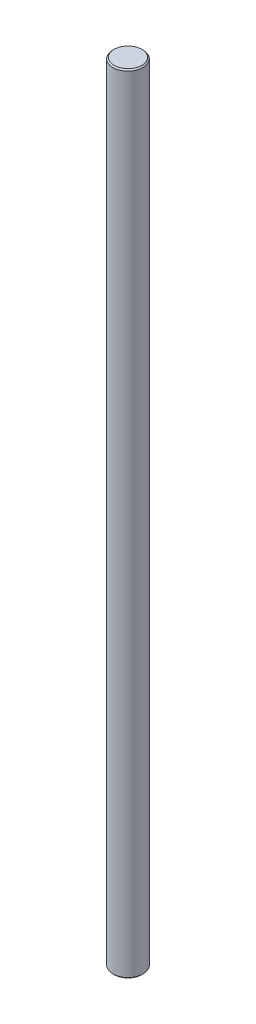
from build123d import *

# Parameters (mm, degrees)
CROQUIS1_R              = 6
SALIENTE_EXTRUIR1_DEPTH = 312
CHAFL_N1_SIZE           = 0.5


with BuildPart() as part:
    # Croquis1 → Saliente-Extruir1 (new body)
    with BuildSketch(Plane(origin=(0, 0, 0), x_dir=(1, 0, 0), z_dir=(0, 1, 0))):
        with Locations(Location((0, 0, 0), (0, 0, 270))):
            Circle(CROQUIS1_R)
    extrude(amount=SALIENTE_EXTRUIR1_DEPTH)

    # Chaflán1
    chafl_n1_edges = [part.edges().sort_by_distance(p)[0] for p in [
        (0, 0, -6),
        (0, 312, -6),
    ]]
    chamfer(chafl_n1_edges, length=CHAFL_N1_SIZE)


solid = part.part
